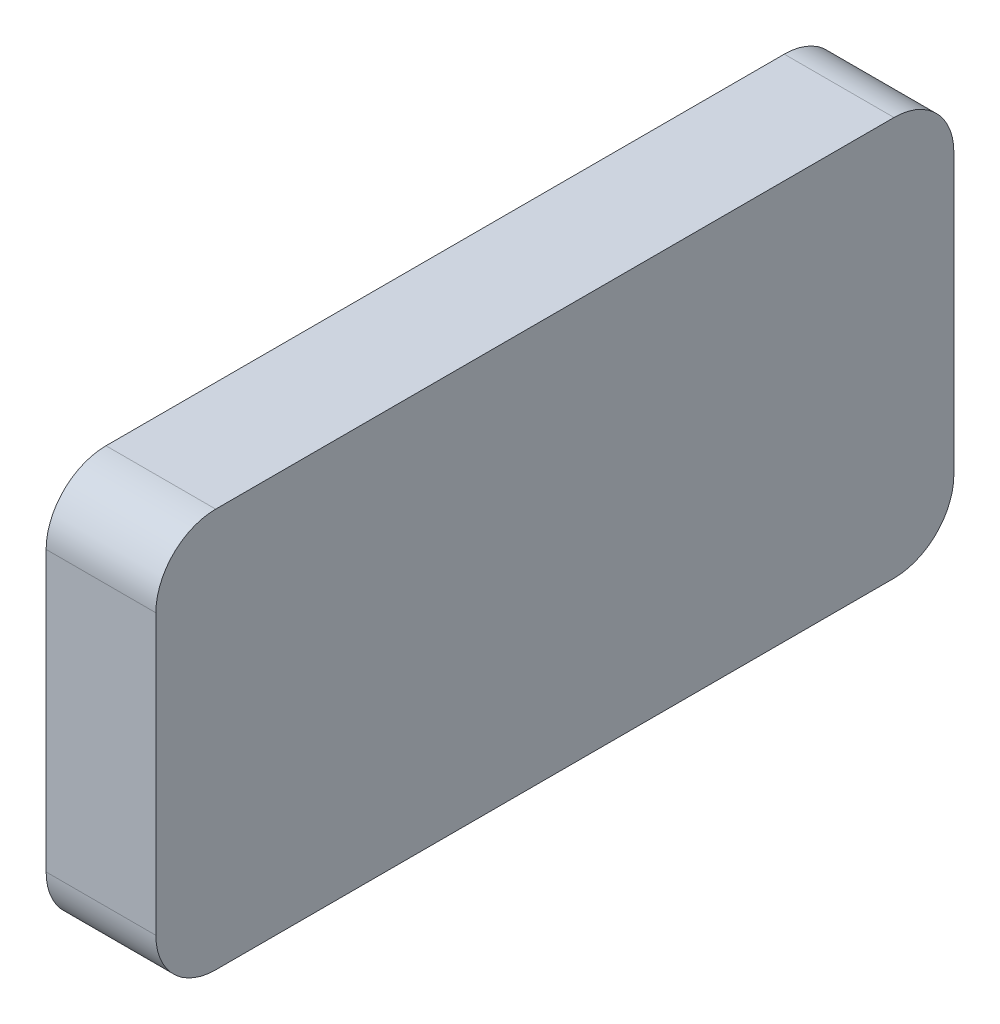
from build123d import *

# Parameters (mm, degrees)
DRIVER_START = 61
DRIVER_DEPTH = 5.5


with BuildPart() as part:
    # Sketch1 → Driver (new body)
    with BuildSketch(Plane(origin=(0, 0, 0), x_dir=(0, 0, -1), z_dir=(1, 0, 0)).offset(DRIVER_START)):
        with BuildLine():
            Line((24, 5.8), (24, 19.8))
            ThreePointArc((24, 19.8), (23.121320344, 21.921320344), (21, 22.8))
            Line((21, 22.8), (-13, 22.8))
            ThreePointArc((-13, 22.8), (-15.121320344, 21.921320344), (-16, 19.8))
            Line((-16, 19.8), (-16, 5.8))
            ThreePointArc((-16, 5.8), (-15.121320344, 3.678679656), (-13, 2.8))
            Line((-13, 2.8), (21, 2.8))
            ThreePointArc((21, 2.8), (23.121320344, 3.678679656), (24, 5.8))
        make_face()
    extrude(amount=DRIVER_DEPTH)


solid = part.part
